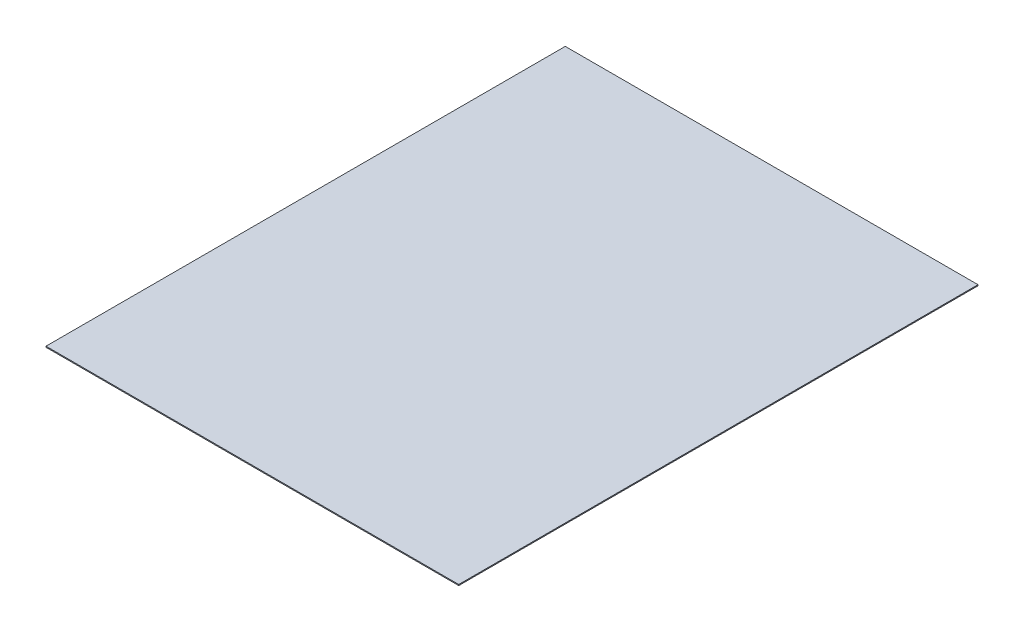
from build123d import *

# Parameters (mm, degrees)
PRESS_UC_RAFI_RAF_1_START = -20
SKETCH1_W                 = 620
SKETCH1_H                 = 1.5
PRESS_UC_RAFI_RAF_1_DEPTH = 780


with BuildPart() as part:
    # Sketch1 → PRESS_uc_rafi_raf_1 (new body)
    with BuildSketch(Plane.XY.offset(PRESS_UC_RAFI_RAF_1_START)):
        with Locations((350, 1152.75)):
            Rectangle(SKETCH1_W, SKETCH1_H)
    extrude(amount=-PRESS_UC_RAFI_RAF_1_DEPTH)


solid = part.part
